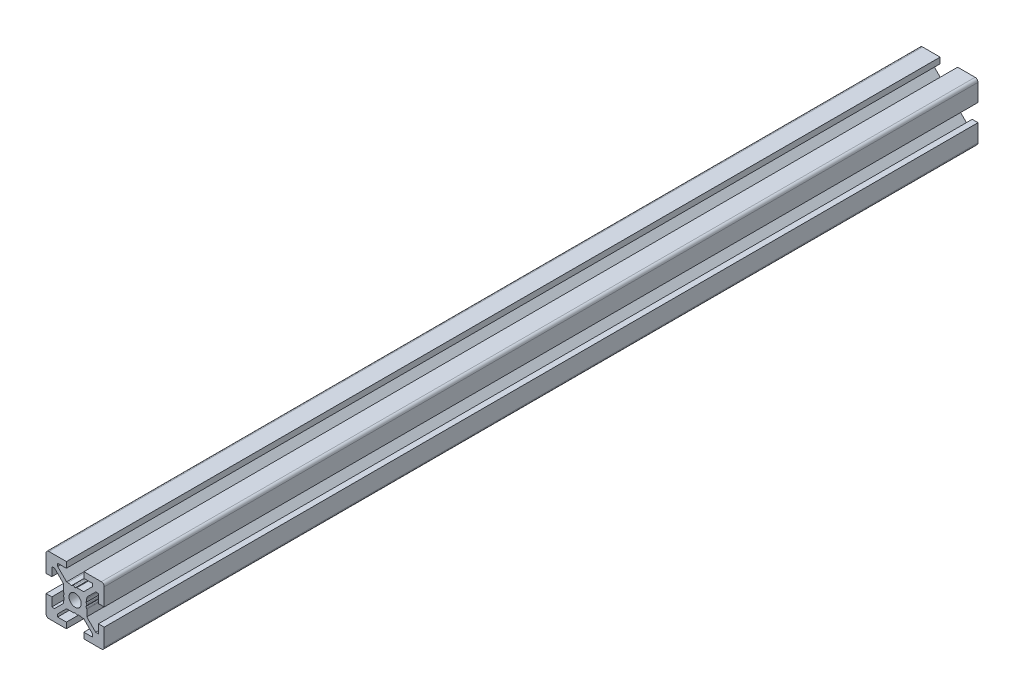
from build123d import *

# Parameters (mm, degrees)
SKETCH1_R           = 2.1
BOSS_EXTRUDE1_DEPTH = 300


with BuildPart() as part:
    # Sketch1 → Boss-Extrude1 (new body)
    with BuildSketch(Plane(origin=(0, 0, -2000), x_dir=(-1, 0, 0), z_dir=(0, 0, -1))):
        with BuildLine():
            Line((10, -3), (8, -3))
            Line((8, -3), (8, -6))
            Line((8, -6), (7.060660172, -6))
            Line((7.060660172, -6), (4, -2.939339828))
            Line((4, -2.939339828), (4, -2.5))
            Line((4, -2.5), (3.750976592, -1.218885629))
            Line((3.750976592, -1.218885629), (3.933012702, -0.903589838))
            ThreePointArc((3.933012702, -0.903589838), (4, -0.653589838), (3.933012702, -0.403589838))
            Line((3.933012702, -0.403589838), (3.7, 0))
            Line((3.7, 0), (3.933012702, 0.403589838))
            ThreePointArc((3.933012702, 0.403589838), (3.982962913, 0.524180316), (4, 0.653589838))
            Line((4, 0.653589838), (4, 2.939339828))
            Line((4, 2.939339828), (7.060660172, 6))
            Line((7.060660172, 6), (8, 6))
            Line((8, 6), (8, 3))
            Line((8, 3), (10, 3))
            Line((10, 3), (10, 9))
            ThreePointArc((10, 9), (9.707106781, 9.707106781), (9, 10))
            Line((9, 10), (3, 10))
            Line((3, 10), (3, 8))
            Line((3, 8), (6, 8))
            Line((6, 8), (6, 7.060660172))
            Line((6, 7.060660172), (2.939339828, 4))
            Line((2.939339828, 4), (2.5, 4))
            Line((2.5, 4), (1.218885629, 3.750976592))
            Line((1.218885629, 3.750976592), (0.903589838, 3.933012702))
            ThreePointArc((0.903589838, 3.933012702), (0.653589838, 4), (0.403589838, 3.933012702))
            Line((0.403589838, 3.933012702), (0, 3.7))
            Line((0, 3.7), (-0.403589838, 3.933012702))
            ThreePointArc((-0.403589838, 3.933012702), (-0.524180316, 3.982962913), (-0.653589838, 4))
            Line((-0.653589838, 4), (-2.939339828, 4))
            Line((-2.939339828, 4), (-6, 7.060660172))
            Line((-6, 7.060660172), (-6, 8))
            Line((-6, 8), (-3, 8))
            Line((-3, 8), (-3, 10))
            Line((-3, 10), (-9, 10))
            ThreePointArc((-9, 10), (-9.707106781, 9.707106781), (-10, 9))
            Line((-10, 9), (-10, 3))
            Line((-10, 3), (-8, 3))
            Line((-8, 3), (-8, 6))
            Line((-8, 6), (-7.060660172, 6))
            Line((-7.060660172, 6), (-4, 2.939339828))
            Line((-4, 2.939339828), (-4, 2.5))
            Line((-4, 2.5), (-3.750976592, 1.218885629))
            Line((-3.750976592, 1.218885629), (-3.933012702, 0.903589838))
            ThreePointArc((-3.933012702, 0.903589838), (-4, 0.653589838), (-3.933012702, 0.403589838))
            Line((-3.933012702, 0.403589838), (-3.7, 0))
            Line((-3.7, 0), (-3.933012702, -0.403589838))
            ThreePointArc((-3.933012702, -0.403589838), (-3.982962913, -0.524180316), (-4, -0.653589838))
            Line((-4, -0.653589838), (-4, -2.939339828))
            Line((-4, -2.939339828), (-7.060660172, -6))
            Line((-7.060660172, -6), (-8, -6))
            Line((-8, -6), (-8, -3))
            Line((-8, -3), (-10, -3))
            Line((-10, -3), (-10, -9))
            ThreePointArc((-10, -9), (-9.707106781, -9.707106781), (-9, -10))
            Line((-9, -10), (-3, -10))
            Line((-3, -10), (-3, -8))
            Line((-3, -8), (-6, -8))
            Line((-6, -8), (-6, -7.060660172))
            Line((-6, -7.060660172), (-2.939339828, -4))
            Line((-2.939339828, -4), (-2.5, -4))
            Line((-2.5, -4), (-1.218885629, -3.750976592))
            Line((-1.218885629, -3.750976592), (-0.903589838, -3.933012702))
            ThreePointArc((-0.903589838, -3.933012702), (-0.653589838, -4), (-0.403589838, -3.933012702))
            Line((-0.403589838, -3.933012702), (0, -3.7))
            Line((0, -3.7), (0.403589838, -3.933012702))
            ThreePointArc((0.403589838, -3.933012702), (0.524180316, -3.982962913), (0.653589838, -4))
            Line((0.653589838, -4), (2.939339828, -4))
            Line((2.939339828, -4), (6, -7.060660172))
            Line((6, -7.060660172), (6, -8))
            Line((6, -8), (3, -8))
            Line((3, -8), (3, -10))
            Line((3, -10), (9, -10))
            ThreePointArc((9, -10), (9.707106781, -9.707106781), (10, -9))
            Line((10, -9), (10, -3))
        make_face()
        with Locations(Location((0, 0, 0), (0, 0, 180))):
            Circle(SKETCH1_R, mode=Mode.SUBTRACT)
    extrude(amount=-BOSS_EXTRUDE1_DEPTH)


solid = part.part
